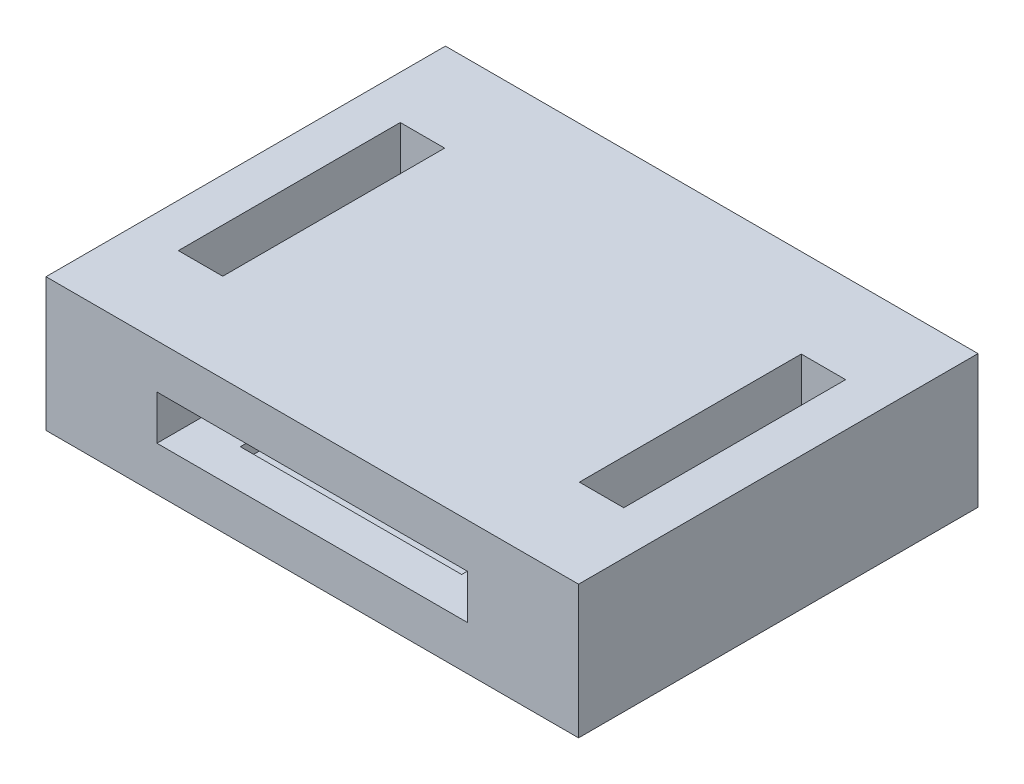
from build123d import *

# Parameters (mm, degrees)
SKETCH1_W           = 30.48
SKETCH1_H           = 22.86
SKETCH1_W_2         = 2.54
SKETCH1_H_2         = 12.7
BOSS_EXTRUDE2_DEPTH = 2.54
SKETCH3_R           = 1.016
BOSS_EXTRUDE3_DEPTH = 2.54
SKETCH4_W           = 30.48
SKETCH4_H           = 22.86
SKETCH4_W_2         = 2.54
SKETCH4_H_2         = 12.7
BOSS_EXTRUDE6_DEPTH = 2.54
SKETCH5_W           = 2.54
SKETCH5_H           = 12.7
BOSS_EXTRUDE7_DEPTH = 2.54
SKETCH6_W           = 12.669882096
SKETCH6_H           = 8.096264029
CUT_EXTRUDE1_DEPTH  = 0.762


with BuildPart() as part:
    # Sketch1 → Boss-Extrude2 (new body)
    with BuildSketch(Plane(origin=(0, 0, 0), x_dir=(1, 0, 0), z_dir=(0, 1, 0))):
        Rectangle(SKETCH1_W, SKETCH1_H)
        with Locations((-11.47489899, 0)):
            Rectangle(SKETCH1_W_2, SKETCH1_H_2, mode=Mode.SUBTRACT)
        with Locations((11.47489899, 0)):
            Rectangle(SKETCH1_W_2, SKETCH1_H_2, mode=Mode.SUBTRACT)
    extrude(amount=BOSS_EXTRUDE2_DEPTH)

    # Sketch3 → Boss-Extrude3 (add)
    with BuildSketch(Plane(origin=(0, 2.54, 0), x_dir=(1, 0, 0), z_dir=(0, 1, 0))):
        with Locations(Location((-5.318941048, 1.27, 0), (0, 0, 90))):
            Circle(SKETCH3_R)
        with Locations(Location((5.318941048, 1.27, 0), (0, 0, 90))):
            Circle(SKETCH3_R)
    extrude(amount=BOSS_EXTRUDE3_DEPTH)

    # Sketch4 → Boss-Extrude6 (add)
    with BuildSketch(Plane(origin=(0, 5.08, 0), x_dir=(1, 0, 0), z_dir=(0, 1, 0))):
        Rectangle(SKETCH4_W, SKETCH4_H)
        with Locations((-11.47489899, 0)):
            Rectangle(SKETCH4_W_2, SKETCH4_H_2, mode=Mode.SUBTRACT)
        with Locations((11.47489899, 0)):
            Rectangle(SKETCH4_W_2, SKETCH4_H_2, mode=Mode.SUBTRACT)
    extrude(amount=BOSS_EXTRUDE6_DEPTH)

    # Sketch5 → Boss-Extrude7 (add)
    with BuildSketch(Plane(origin=(0, 2.54, 0), x_dir=(1, 0, 0), z_dir=(0, 1, 0))):
        Polygon((-15.24, -11.43), (-15.24, 11.43), (15.24, 11.43), (15.24, -11.43), (8.89, -11.43), (8.89, 6.35), (-8.89, 6.35), (-8.89, -11.43), align=None)
        with Locations((-11.47489899, 0)):
            Rectangle(SKETCH5_W, SKETCH5_H, mode=Mode.SUBTRACT)
        with Locations((11.47489899, 0)):
            Rectangle(SKETCH5_W, SKETCH5_H, mode=Mode.SUBTRACT)
    extrude(amount=BOSS_EXTRUDE7_DEPTH)

    # Sketch6 → Cut-Extrude1 (cut)
    with BuildSketch(Plane(origin=(0, 2.54, 0), x_dir=(1, 0, 0), z_dir=(0, 1, 0))):
        with Locations((0, -5.167320683)):
            Rectangle(SKETCH6_W, SKETCH6_H)
    extrude(amount=-CUT_EXTRUDE1_DEPTH, mode=Mode.SUBTRACT)


solid = part.part
